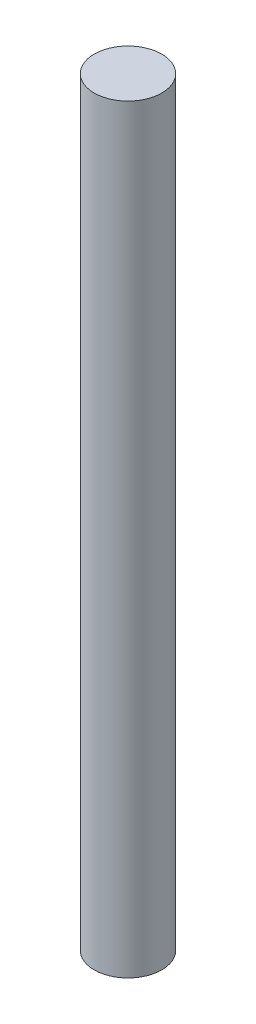
from build123d import *

# Parameters (mm, degrees)
SKETCH_1_R      = 40
EXTRUDE_1_DEPTH = 450


with BuildPart() as part:
    # 草图1 → 凸台-拉伸1 (new, symmetric)
    with BuildSketch(Plane(origin=(0, 0, 0), x_dir=(1, 0, 0), z_dir=(0, 1, 0))):
        with Locations(Location((0, 0, 0), (0, 0, 270))):
            Circle(SKETCH_1_R)
    extrude(amount=EXTRUDE_1_DEPTH, both=True)


solid = part.part
